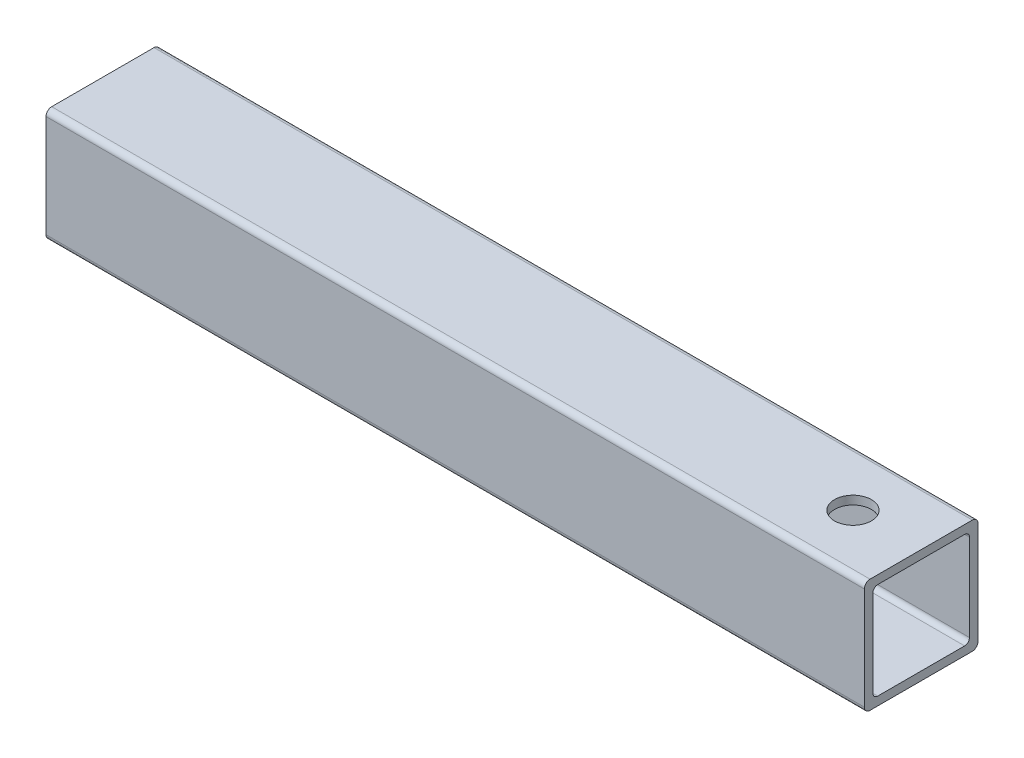
from build123d import *

# Parameters (mm, degrees)
SQUARE_TUBE_2_5X2_5X_188_A500_1_DEPTH = 457.2
SKETCH3_R                             = 10.3251
CUT_EXTRUDE1_DEPTH                    = 4.7752


with BuildPart() as part:
    # Sketch1 → Square tube 2.5X2.5X.188 A500(1) (new body)
    with BuildSketch(Plane.YZ):
        with BuildLine():
            Line((28.575, -31.75), (-28.575, -31.75))
            ThreePointArc((-28.575, -31.75), (-30.82006403, -30.82006403), (-31.75, -28.575))
            Line((-31.75, -28.575), (-31.75, 28.575))
            ThreePointArc((-31.75, 28.575), (-30.82006403, 30.82006403), (-28.575, 31.75))
            Line((-28.575, 31.75), (28.575, 31.75))
            ThreePointArc((28.575, 31.75), (30.82006403, 30.82006403), (31.75, 28.575))
            Line((31.75, 28.575), (31.75, -28.575))
            ThreePointArc((31.75, -28.575), (30.82006403, -30.82006403), (28.575, -31.75))
        make_face()
        with BuildLine():
            Line((24.27732, 26.9748), (-24.27732, 26.9748))
            ThreePointArc((-24.27732, 26.9748), (-26.1847264, 26.1847264), (-26.9748, 24.27732))
            Line((-26.9748, 24.27732), (-26.9748, -24.27732))
            ThreePointArc((-26.9748, -24.27732), (-26.1847264, -26.1847264), (-24.27732, -26.9748))
            Line((-24.27732, -26.9748), (24.27732, -26.9748))
            ThreePointArc((24.27732, -26.9748), (26.1847264, -26.1847264), (26.9748, -24.27732))
            Line((26.9748, -24.27732), (26.9748, 24.27732))
            ThreePointArc((26.9748, 24.27732), (26.1847264, 26.1847264), (24.27732, 26.9748))
        make_face(mode=Mode.SUBTRACT)
    extrude(amount=SQUARE_TUBE_2_5X2_5X_188_A500_1_DEPTH)

    # Sketch3 → Cut-Extrude1 (cut)
    with BuildSketch(Plane(origin=(0, 31.75, 0), x_dir=(1, 0, 0), z_dir=(0, 1, 0))):
        with Locations(Location((419.1, 0, 0), (0, 0, 270))):
            Circle(SKETCH3_R)
    extrude(amount=-CUT_EXTRUDE1_DEPTH, mode=Mode.SUBTRACT)


solid = part.part
